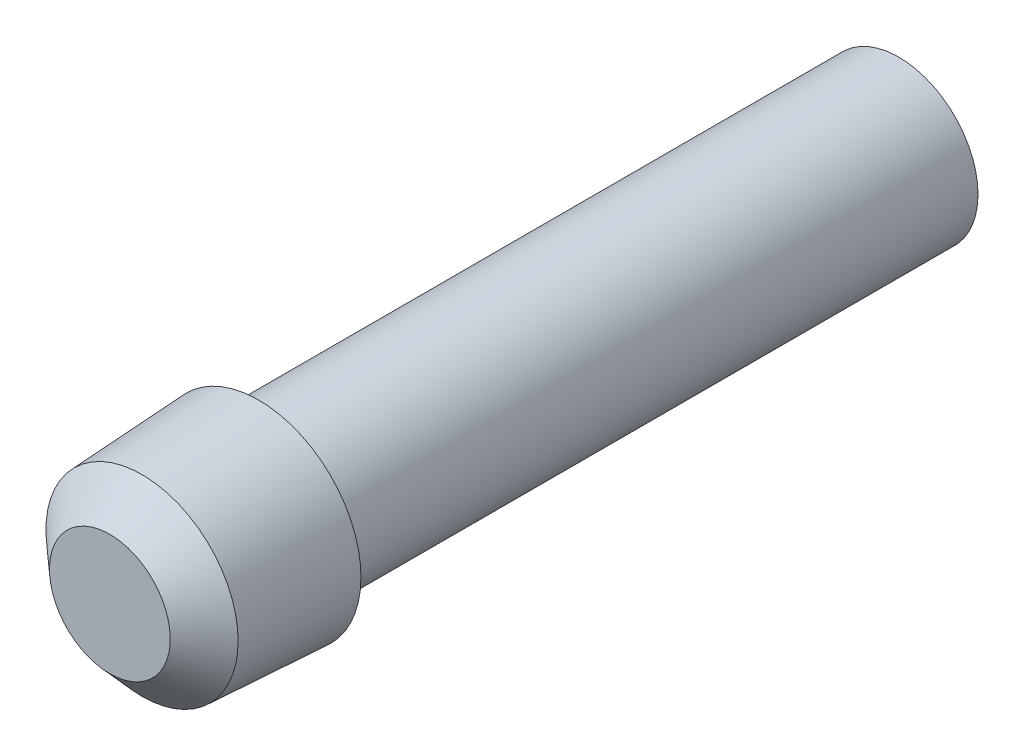
from build123d import *

# Parameters (mm, degrees)
SKETCH1_R           = 1.25
SKETCH1_R_2         = 0.7
BOSS_EXTRUDE1_DEPTH = 12.45
DRAFT1_ANGLE        = -2
BOSS_EXTRUDE2_START = -3.175
SKETCH2_R           = 1.25
BOSS_EXTRUDE2_DEPTH = 3.175
BOSS_EXTRUDE3_START = -2.3495
SKETCH3_R           = 1.6129
SKETCH3_R_2         = 1.25
BOSS_EXTRUDE3_DEPTH = 2.3495
DRAFT2_ANGLE        = -3
CHAMFER1_SIZE       = 0.508
CHAMFER1_SIZE2      = 0.491158032
CHAMFER2_SIZE       = 0.508
CHAMFER2_SIZE2      = 0.536831287


with BuildPart() as part:
    # Sketch1 → Boss-Extrude1 (new body)
    with BuildSketch(Plane.XY):
        with Locations(Location((0, 6.009690382, 0), (0, 0, 270))):
            Circle(SKETCH1_R)
        with Locations(Location((0, 6.009690382, 0), (0, 0, 270))):
            Circle(SKETCH1_R_2, mode=Mode.SUBTRACT)
    extrude(amount=BOSS_EXTRUDE1_DEPTH)

    # Draft1
    draft1_faces = [part.faces().sort_by_distance(p)[0] for p in [
        (0, 6.709690382, 6.225),
    ]]
    draft(draft1_faces, Plane(origin=(0, 6.009690382, 0), x_dir=(-1, 0, 0), z_dir=(0, 0, -1)), DRAFT1_ANGLE)

    # Sketch2 → Boss-Extrude2 (add)
    with BuildSketch(Plane.XY.offset(12.45).offset(BOSS_EXTRUDE2_START)):
        with Locations(Location((0, 6.009690382, 0), (0, 0, 270))):
            Circle(SKETCH2_R)
    extrude(amount=BOSS_EXTRUDE2_DEPTH)

    # Sketch3 → Boss-Extrude3 (add)
    with BuildSketch(Plane.XY.offset(12.45).offset(BOSS_EXTRUDE3_START)):
        with Locations((0, 6.009690382)):
            Circle(SKETCH3_R)
        with Locations((0, 6.009690382)):
            Circle(SKETCH3_R_2, mode=Mode.SUBTRACT)
    extrude(amount=BOSS_EXTRUDE3_DEPTH)

    # Draft2
    draft2_faces = [part.faces().sort_by_distance(p)[0] for p in [
        (-1.6129, 6.009690382, 11.27525),
    ]]
    draft(draft2_faces, Plane(origin=(0, 6.009690382, 10.1005), x_dir=(-1, 0, 0), z_dir=(0, 0, -1)), DRAFT2_ANGLE)

    # Chamfer1
    chamfer1_edges = [part.edges().sort_by_distance(p)[0] for p in [
        (0, 6.709690382, 0),
    ]]
    chamfer1_side = [part.faces().sort_by_distance(p)[0] for p in [
        (0, 6.871635451, 4.6375),
    ]]
    chamfer(chamfer1_edges, length=CHAMFER1_SIZE, length2=CHAMFER1_SIZE2, reference=chamfer1_side[0])

    # Chamfer2
    chamfer2_edges = [part.edges().sort_by_distance(p)[0] for p in [
        (-1.489767923, 6.009690382, 12.45),
    ]]
    chamfer2_side = [part.faces().sort_by_distance(p)[0] for p in [
        (-1.551333961, 6.009690382, 11.27525),
    ]]
    chamfer(chamfer2_edges, length=CHAMFER2_SIZE, length2=CHAMFER2_SIZE2, reference=chamfer2_side[0])


solid = part.part
